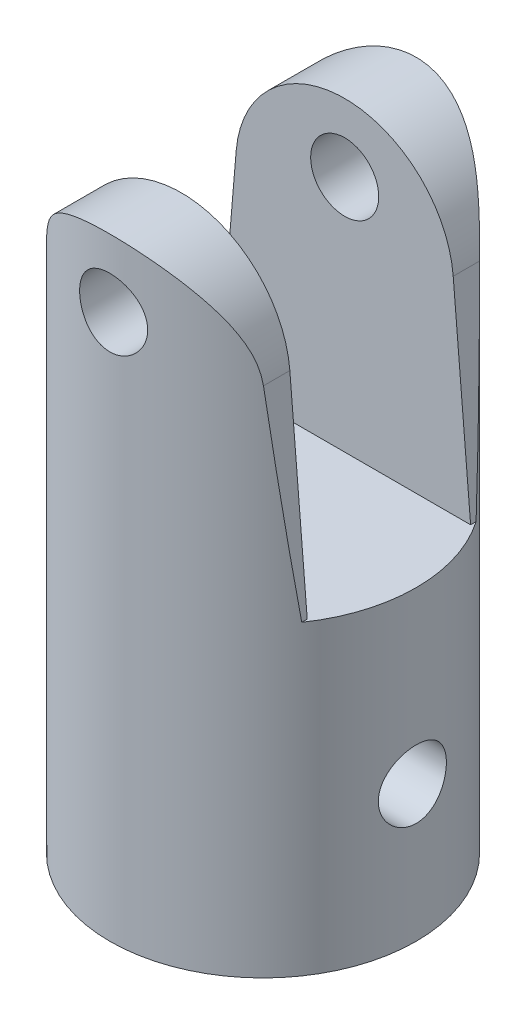
from build123d import *

# Parameters (mm, degrees)
SKETCH1_R               = 7.14375
BOSS_EXTRUDE1_DEPTH     = 14.2875
SKETCH2_R               = 3.175
CUT_EXTRUDE1_DEPTH      = 12.7
SKETCH3_W               = 14.2875
SKETCH3_H               = 7.62
CUT_EXTRUDE2_DEPTH      = 14.2875
CUT_EXTRUDE4_DEPTH      = 18.49854235
CUT_EXTRUDE4_DEPTH_BACK = 18.49854235
CUT_EXTRUDE5_DEPTH      = 18.49854252
CUT_EXTRUDE5_DEPTH_BACK = 18.49854252
SKETCH5_R               = 1.5875
SKETCH6_R               = 1.5875
CUT_EXTRUDE6_DEPTH      = 12.7


with BuildPart() as part:
    # Sketch1 → Boss-Extrude1 (new, symmetric)
    with BuildSketch(Plane(origin=(0, 0, 0), x_dir=(1, 0, 0), z_dir=(0, 1, 0))):
        with Locations(Location((0, 0, 0), (0, 0, 270))):
            Circle(SKETCH1_R)
    extrude(amount=BOSS_EXTRUDE1_DEPTH, both=True)

    # Sketch2 → Cut-Extrude1 (cut)
    with BuildSketch(Plane.XZ.offset(14.2875)):
        with Locations(Location((0, 0, 0), (0, 0, 270))):
            Circle(SKETCH2_R)
    extrude(amount=-CUT_EXTRUDE1_DEPTH, mode=Mode.SUBTRACT)

    # Sketch3 → Cut-Extrude2 (cut)
    with BuildSketch(Plane(origin=(0, 14.2875, 0), x_dir=(1, 0, 0), z_dir=(0, 1, 0))):
        Rectangle(SKETCH3_W, SKETCH3_H)
    extrude(amount=-CUT_EXTRUDE2_DEPTH, mode=Mode.SUBTRACT)

    # Sketch4 → Cut-Extrude4 (cut, two sides: drawn at the far end of the back side and taken through both)
    with BuildSketch(Plane.XY.offset(-CUT_EXTRUDE4_DEPTH_BACK)):
        with BuildLine():
            Line((-57.554902545, 0), (-7.14375, 0))
            Line((-7.14375, 0), (-5.87375, 0))
            Line((-5.87375, 0), (-5.062065416, 9.633990007))
            ThreePointArc((-5.062065416, 9.633990007), (0, 14.2875), (5.062065416, 9.633990007))
            Line((5.062065416, 9.633990007), (5.87375, 0))
            Line((5.87375, 0), (7.14375, 0))
            Line((7.14375, 0), (57.554902545, 0))
            Line((57.554902545, 0), (57.554902545, 100.82230509))
            Line((57.554902545, 100.82230509), (-57.554902545, 100.82230509))
            Line((-57.554902545, 100.82230509), (-57.554902545, 0))
        make_face()
    extrude(amount=CUT_EXTRUDE4_DEPTH + CUT_EXTRUDE4_DEPTH_BACK, mode=Mode.SUBTRACT)

    # Sketch5 → Cut-Extrude5 (cut, two sides: drawn at the far end of the back side and taken through both)
    with BuildSketch(Plane.XY.offset(-CUT_EXTRUDE5_DEPTH_BACK)):
        with Locations(Location((0, 11.1125, 0), (0, 0, 90))):
            Circle(SKETCH5_R)
    extrude(amount=CUT_EXTRUDE5_DEPTH + CUT_EXTRUDE5_DEPTH_BACK, mode=Mode.SUBTRACT)

    # Sketch6 → Cut-Extrude6 (cut, symmetric)
    with BuildSketch(Plane(origin=(0, 0, 0), x_dir=(0, 0, -1), z_dir=(1, 0, 0))):
        with Locations((0, -7.9375)):
            Circle(SKETCH6_R)
    extrude(amount=CUT_EXTRUDE6_DEPTH, both=True, mode=Mode.SUBTRACT)


solid = part.part
